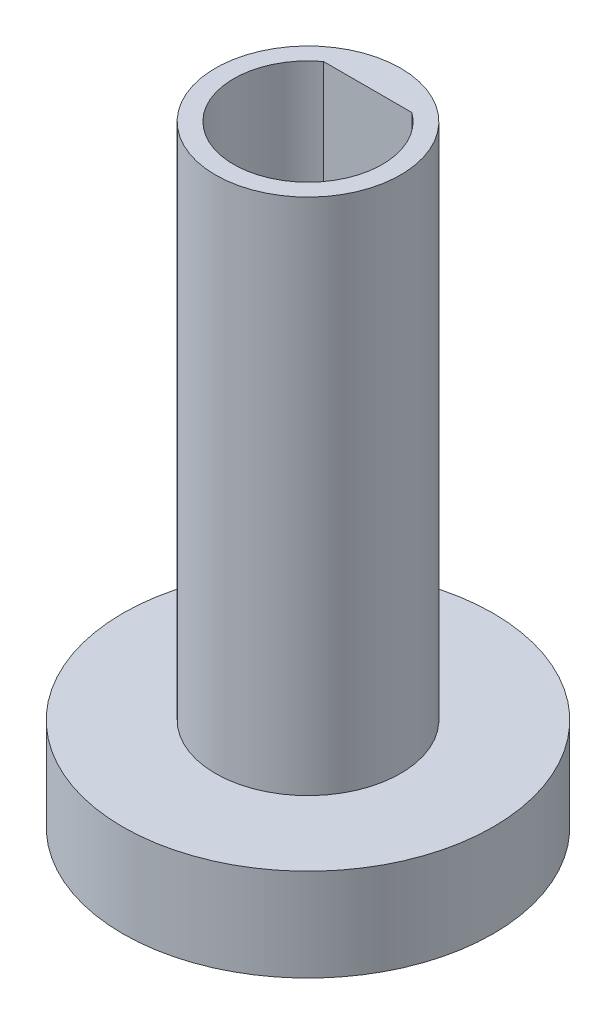
from build123d import *

# Parameters (mm, degrees)
SKETCH1_R           = 6.35
BOSS_EXTRUDE1_DEPTH = 3.175
SKETCH2_R           = 3.175
BOSS_EXTRUDE2_DEPTH = 17.78
CUT_EXTRUDE1_DEPTH  = 17.78
SKETCH4_R           = 0.762
CUT_EXTRUDE2_DEPTH  = 23.7981803


with BuildPart() as part:
    # Sketch1 → Boss-Extrude1 (new body)
    with BuildSketch(Plane(origin=(0, 0, 0), x_dir=(1, 0, 0), z_dir=(0, 1, 0))):
        with Locations(Location((0, 0, 0), (0, 0, 270))):
            Circle(SKETCH1_R)
    extrude(amount=BOSS_EXTRUDE1_DEPTH)

    # Sketch2 → Boss-Extrude2 (add)
    with BuildSketch(Plane(origin=(0, 3.175, 0), x_dir=(1, 0, 0), z_dir=(0, 1, 0))):
        with Locations(Location((0, 0, 0), (0, 0, 270))):
            Circle(SKETCH2_R)
    extrude(amount=BOSS_EXTRUDE2_DEPTH)

    # Sketch3 → Cut-Extrude1 (cut)
    with BuildSketch(Plane(origin=(0, 20.955, 0), x_dir=(1, 0, 0), z_dir=(0, 1, 0))):
        with BuildLine():
            Line((-1.516575089, 2.05), (1.516575089, 2.05))
            ThreePointArc((1.516575089, 2.05), (0, -2.55), (-1.516575089, 2.05))
        make_face()
    extrude(amount=-CUT_EXTRUDE1_DEPTH, mode=Mode.SUBTRACT)

    # Sketch4 → Cut-Extrude2 (cut, through all)
    with BuildSketch(Plane.XZ):
        with Locations(Location((0, 0, 0), (0, 0, 270))):
            Circle(SKETCH4_R)
    extrude(amount=-CUT_EXTRUDE2_DEPTH, mode=Mode.SUBTRACT)


solid = part.part
